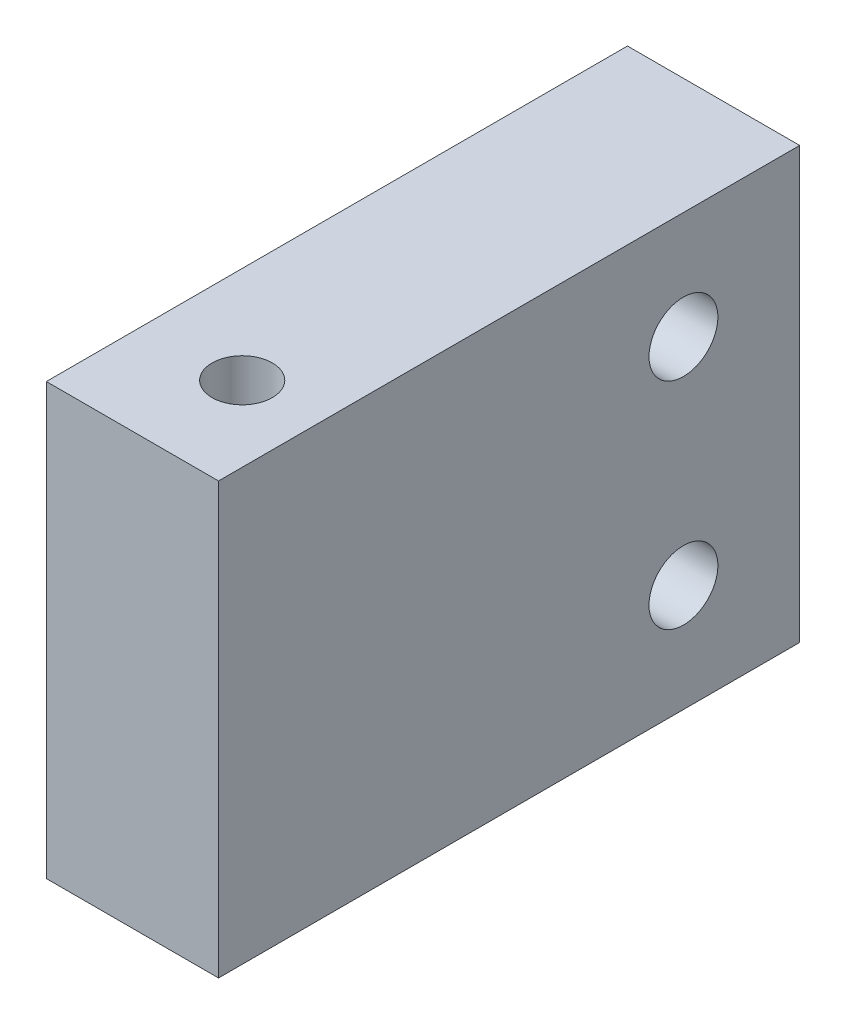
from build123d import *

# Parameters (mm, degrees)
SKETCH1_W           = 10.16
SKETCH1_H           = 25.4
SKETCH1_R           = 1.776811913
BOSS_EXTRUDE1_DEPTH = 25.4
SKETCH2_W           = 10.16
SKETCH2_H           = 25.4
BOSS_EXTRUDE2_DEPTH = 5.08
SKETCH4_W           = 10.16
SKETCH4_H           = 25.4
BOSS_EXTRUDE3_DEPTH = 3.81
SKETCH3_R           = 2.032
CUT_EXTRUDE1_DEPTH  = 62.036581459


with BuildPart() as part:
    # Sketch1 → Boss-Extrude1 (new body)
    with BuildSketch(Plane(origin=(0, 0, 0), x_dir=(1, 0, 0), z_dir=(0, 1, 0))):
        with Locations((-5.08, 32.972612439)):
            Rectangle(SKETCH1_W, SKETCH1_H)
        with Locations(Location((-4.445, 26.114612439, 0), (0, 0, 270))):
            Circle(SKETCH1_R, mode=Mode.SUBTRACT)
    extrude(amount=BOSS_EXTRUDE1_DEPTH)

    # Sketch2 → Boss-Extrude2 (add)
    with BuildSketch(Plane(origin=(0, 0, -45.672612439), x_dir=(-1, 0, 0), z_dir=(0, 0, -1))):
        with Locations((5.08, 12.7)):
            Rectangle(SKETCH2_W, SKETCH2_H)
    extrude(amount=BOSS_EXTRUDE2_DEPTH)

    # Sketch4 → Boss-Extrude3 (add)
    with BuildSketch(Plane(origin=(0, 0, -50.752612439), x_dir=(-1, 0, 0), z_dir=(0, 0, -1))):
        with Locations((5.08, 12.7)):
            Rectangle(SKETCH4_W, SKETCH4_H)
    extrude(amount=BOSS_EXTRUDE3_DEPTH)

    # Sketch3 → Cut-Extrude1 (cut, through all)
    with BuildSketch(Plane.ZY.offset(10.16)):
        with Locations((-47.704612439, 19.05)):
            Circle(SKETCH3_R)
        with Locations((-47.704612439, 6.35)):
            Circle(SKETCH3_R)
    extrude(amount=-CUT_EXTRUDE1_DEPTH, mode=Mode.SUBTRACT)


solid = part.part
